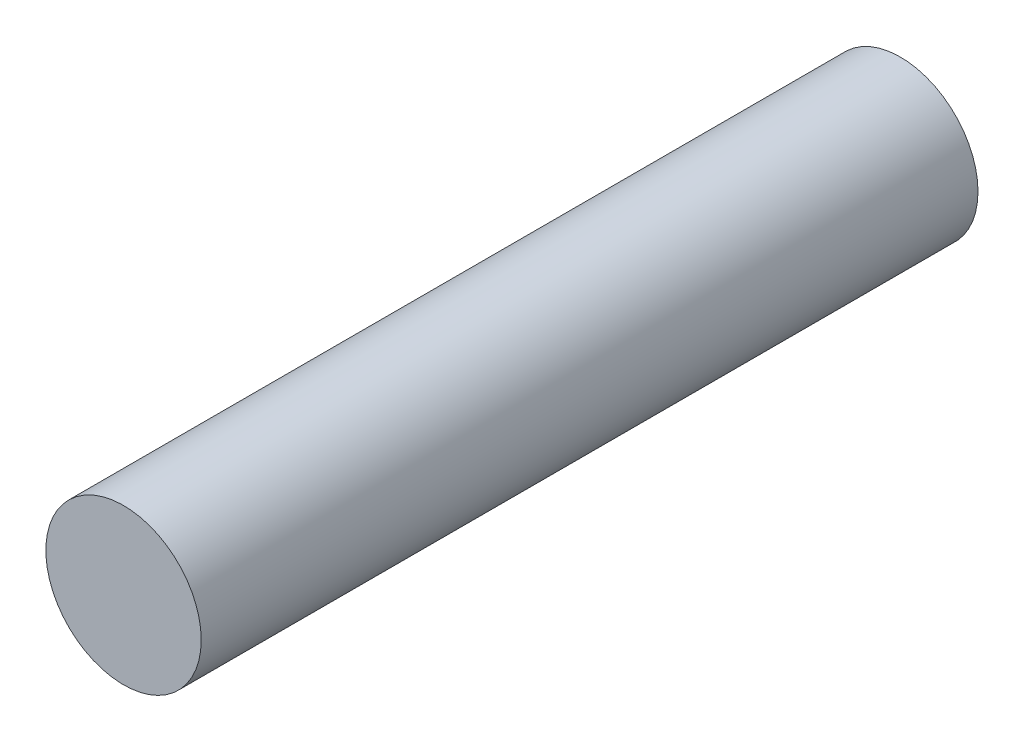
from build123d import *

# Parameters (mm, degrees)
S01_M6_CONNECTING_STUD_R      = 3
F_01_M6_CONNECTING_STUD_DEPTH = 30
F_02_START                    = -0.1
F_02_HEX_KEY_SOCKET_DEPTH     = 3.1


with BuildPart() as part:
    # S01 - M6 connecting stud → 01 - M6 connecting stud (new body)
    with BuildSketch(Plane.XY):
        Circle(S01_M6_CONNECTING_STUD_R)
    extrude(amount=F_01_M6_CONNECTING_STUD_DEPTH)

    # S02 - Hex key socket → 02 - Hex key socket (cut)
    with BuildSketch(Plane.XY.offset(F_02_START)):
        Polygon((1.732050808, 0), (0.866025404, 1.5), (-0.866025404, 1.5), (-1.732050808, 0), (-0.866025404, -1.5), (0.866025404, -1.5), align=None)
    extrude(amount=F_02_HEX_KEY_SOCKET_DEPTH, mode=Mode.SUBTRACT)


solid = part.part
